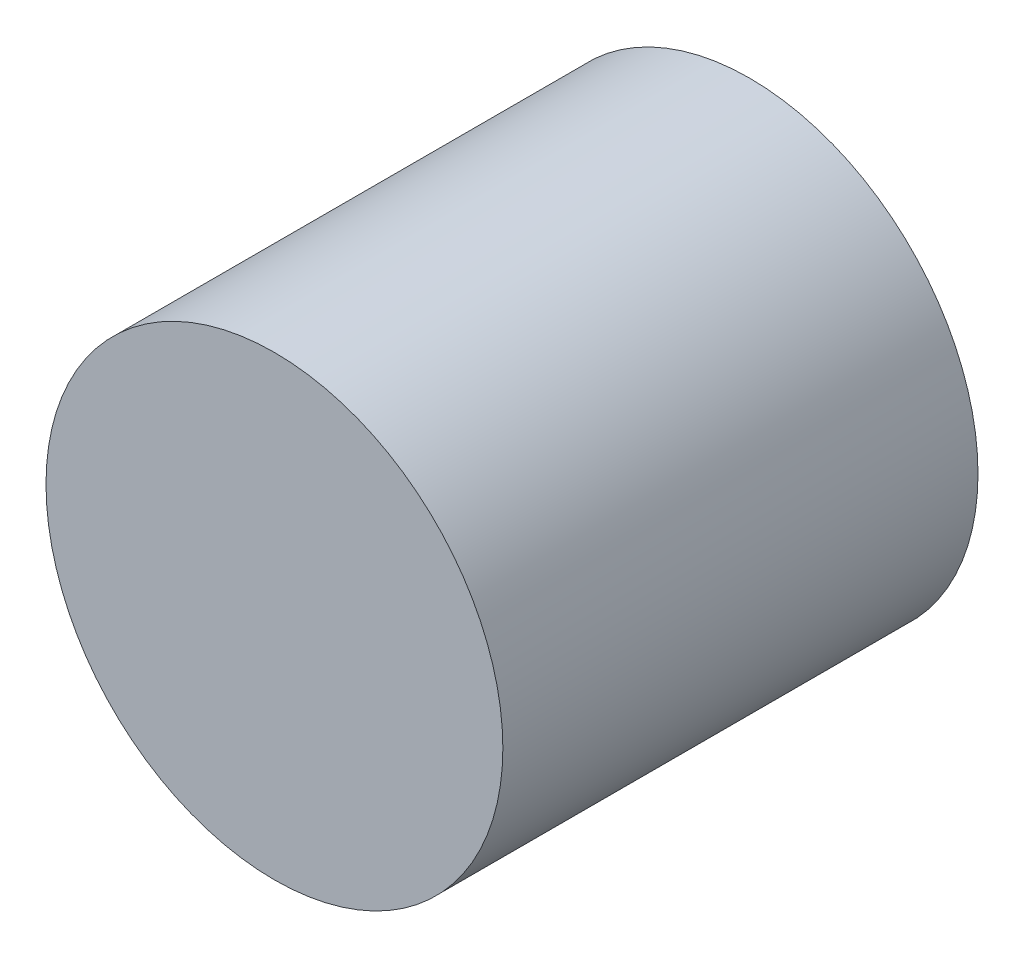
from build123d import *

# Parameters (mm, degrees)
SKETCH1_R           = 4.7625
BOSS_EXTRUDE1_DEPTH = 9.906


with BuildPart() as part:
    # Sketch1 → Boss-Extrude1 (new body)
    with BuildSketch(Plane.XY):
        Circle(SKETCH1_R)
    extrude(amount=BOSS_EXTRUDE1_DEPTH)


solid = part.part
